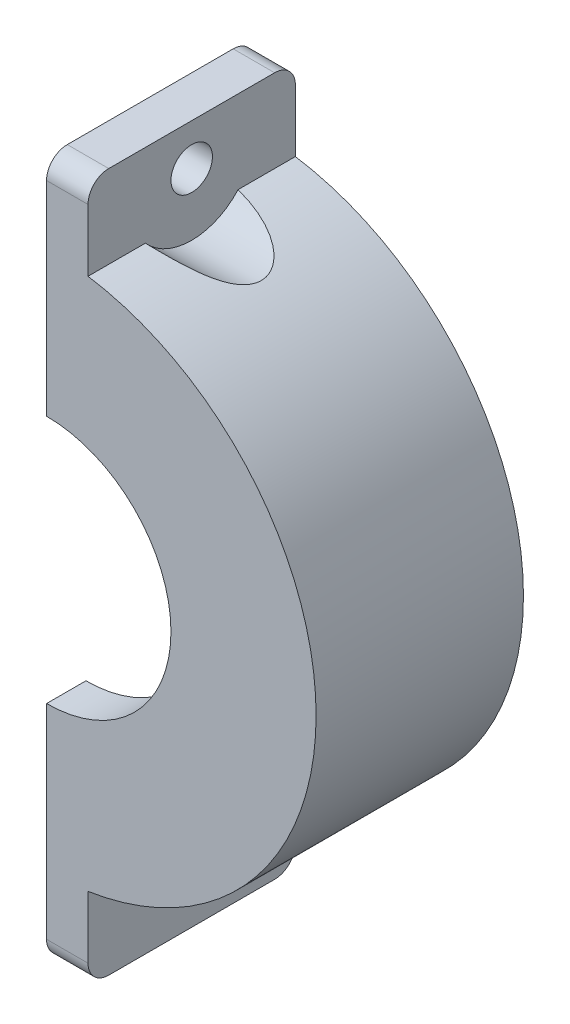
from build123d import *

# Parameters (mm, degrees)
SKETCH1_R           = 13
BOSS_EXTRUDE1_DEPTH = 10
CUT_EXTRUDE1_DEPTH  = 10
SKETCH4_R           = 11
CUT_EXTRUDE2_DEPTH  = 8.1
BOSS_EXTRUDE2_START = 11.845233
SKETCH5_W           = 2
SKETCH5_H           = 10
BOSS_EXTRUDE2_DEPTH = 5
BOSS_EXTRUDE3_START = -16.845233
SKETCH5_2_W         = 2
SKETCH5_2_H         = 10
BOSS_EXTRUDE3_DEPTH = 5
SKETCH6_R           = 1
CUT_EXTRUDE3_DEPTH  = 5
SKETCH7_R           = 1
CUT_EXTRUDE4_DEPTH  = 5
SKETCH8_R           = 6
CUT_EXTRUDE5_DEPTH  = 10
CUT_EXTRUDE6_START  = 10
SKETCH9_R           = 3
CUT_EXTRUDE6_DEPTH  = 8
CUT_EXTRUDE7_START  = 10
SKETCH10_R          = 3
CUT_EXTRUDE7_DEPTH  = 8
FILLET1_R           = 1
FILLET2_R           = 1
FILLET3_R           = 1
FILLET4_R           = 1


with BuildPart() as part:
    # Sketch1 → Boss-Extrude1 (new body)
    with BuildSketch(Plane.XY):
        Circle(SKETCH1_R)
    extrude(amount=BOSS_EXTRUDE1_DEPTH)

    # Sketch2 → Cut-Extrude1 (cut)
    with BuildSketch(Plane.XY.offset(10)):
        Polygon((0, 0), (0, -13.849459762), (-21.443242854, -13.849459762), (-21.443242854, 14.185204241), (0, 14.185204241), align=None)
    extrude(amount=-CUT_EXTRUDE1_DEPTH, mode=Mode.SUBTRACT)

    # Sketch4 → Cut-Extrude2 (cut)
    with BuildSketch(Plane(origin=(0, 0, 0), x_dir=(-1, 0, 0), z_dir=(0, 0, -1))):
        Circle(SKETCH4_R)
    extrude(amount=-CUT_EXTRUDE2_DEPTH, mode=Mode.SUBTRACT)

    # Sketch5 → Boss-Extrude2 (add)
    with BuildSketch(Plane(origin=(0, 0, 0), x_dir=(1, 0, 0), z_dir=(0, 1, 0)).offset(BOSS_EXTRUDE2_START)):
        with Locations((1, -5)):
            Rectangle(SKETCH5_W, SKETCH5_H)
    extrude(amount=BOSS_EXTRUDE2_DEPTH)

    # Sketch5<2> → Boss-Extrude3 (add)
    with BuildSketch(Plane(origin=(0, 0, 0), x_dir=(1, 0, 0), z_dir=(0, 1, 0)).offset(BOSS_EXTRUDE3_START)):
        with Locations((1, -5)):
            Rectangle(SKETCH5_2_W, SKETCH5_2_H)
    extrude(amount=BOSS_EXTRUDE3_DEPTH)

    # Sketch6 → Cut-Extrude3 (cut)
    with BuildSketch(Plane(origin=(2, 0, 0), x_dir=(0, 0, -1), z_dir=(1, 0, 0))):
        with Locations((-5, 14.845233)):
            Circle(SKETCH6_R)
    extrude(amount=-CUT_EXTRUDE3_DEPTH, mode=Mode.SUBTRACT)

    # Sketch7 → Cut-Extrude4 (cut)
    with BuildSketch(Plane(origin=(2, 0, 0), x_dir=(0, 0, -1), z_dir=(1, 0, 0))):
        with Locations((-5, -14.845233)):
            Circle(SKETCH7_R)
    extrude(amount=-CUT_EXTRUDE4_DEPTH, mode=Mode.SUBTRACT)

    # Sketch8 → Cut-Extrude5 (cut)
    with BuildSketch(Plane(origin=(0, 0, 8.1), x_dir=(-1, 0, 0), z_dir=(0, 0, -1))):
        Circle(SKETCH8_R)
    extrude(amount=-CUT_EXTRUDE5_DEPTH, mode=Mode.SUBTRACT)

    # Sketch9 → Cut-Extrude6 (cut)
    with BuildSketch(Plane(origin=(0, 0, 0), x_dir=(0, 0, -1), z_dir=(1, 0, 0)).offset(CUT_EXTRUDE6_START)):
        with Locations((-5, 14.845233)):
            Circle(SKETCH9_R)
    extrude(amount=-CUT_EXTRUDE6_DEPTH, mode=Mode.SUBTRACT)

    # Sketch10 → Cut-Extrude7 (cut)
    with BuildSketch(Plane(origin=(0, 0, 0), x_dir=(0, 0, -1), z_dir=(1, 0, 0)).offset(CUT_EXTRUDE7_START)):
        with Locations((-5, -14.845233)):
            Circle(SKETCH10_R)
    extrude(amount=-CUT_EXTRUDE7_DEPTH, mode=Mode.SUBTRACT)

    # Fillet1
    fillet1_edges = [part.edges().sort_by_distance(p)[0] for p in [
        (1, -16.845233, 0),
    ]]
    fillet(fillet1_edges, radius=FILLET1_R)

    # Fillet2
    fillet2_edges = [part.edges().sort_by_distance(p)[0] for p in [
        (1, 16.845233, 0),
    ]]
    fillet(fillet2_edges, radius=FILLET2_R)

    # Fillet3
    fillet3_edges = [part.edges().sort_by_distance(p)[0] for p in [
        (1, 16.845233, 10),
    ]]
    fillet(fillet3_edges, radius=FILLET3_R)

    # Fillet4
    fillet4_edges = [part.edges().sort_by_distance(p)[0] for p in [
        (1, -16.845233, 10),
    ]]
    fillet(fillet4_edges, radius=FILLET4_R)


solid = part.part
